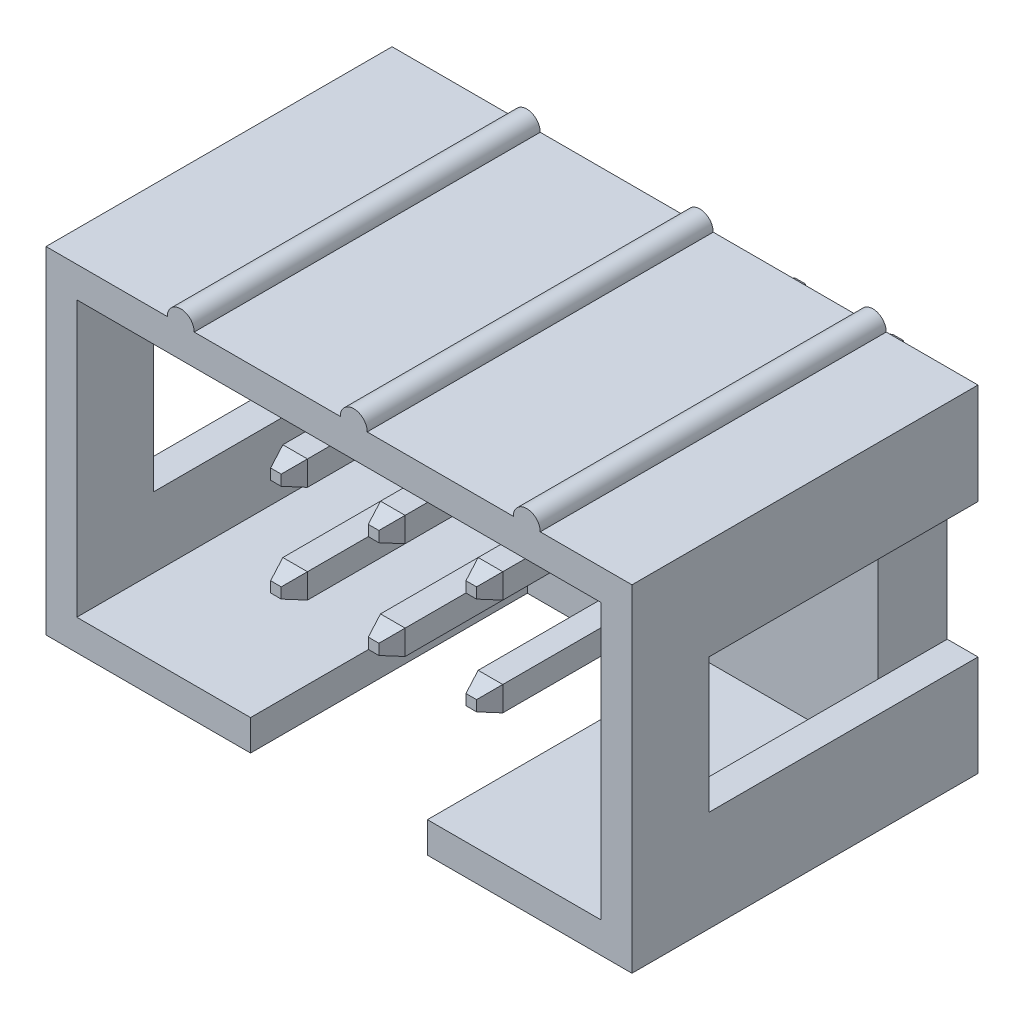
from build123d import *
from OCP.BRepFilletAPI import BRepFilletAPI_MakeChamfer

# Parameters (mm, degrees)
SKETCH_1_W               = 15.24
SKETCH_1_H               = 8.75
EXTRUDE_1_DEPTH          = 1.8
SKETCH_2_W               = 15.24
SKETCH_2_H               = 8.75
SKETCH_2_W_2             = 13.64
SKETCH_2_H_2             = 7.15
EXTRUDE_2_DEPTH          = 7.2
CUT_EXTRUDE_START        = -1.8
SKETCH_3_W               = 0.8
SKETCH_3_H               = 3.5
CUT_EXTRUDE_1_DEPTH      = 7
SKETCH_4_W               = 4.6
SKETCH_4_H               = 0.8
CUT_EXTRUDE_2_DEPTH      = 7.2
EXTRUDE_3_DEPTH          = 6.3
EXTRUDE_3_DEPTH_BACK     = 4.8
SKETCH_5_W               = 0.64
SKETCH_5_H               = 0.64
CHAMFER_2_SIZE           = 0.5
CHAMFER_2_SIZE2          = 0.181985117
CHAMFER_8_SIZE           = 0.5
CHAMFER_8_SIZE2          = 0.181985117
CUT_EXTRUDE_3_DEPTH      = 0.1
PATTERN_LINEAR_1_COUNT   = 2
PATTERN_LINEAR_1_PITCH   = 2.54
PATTERN_LINEAR_1_2_COUNT = 2
PATTERN_LINEAR_1_2_PITCH = 2.54
PATTERN_LINEAR_2_COUNT   = 2
PATTERN_LINEAR_2_PITCH   = 2.54
SKETCH_7_R               = 0.35
EXTRUDE_4_DEPTH          = 9


with BuildPart() as part:
    # Эскиз1 → Бобышка-Вытянуть1 (new body)
    with BuildSketch(Plane.XY):
        Rectangle(SKETCH_1_W, SKETCH_1_H)
    extrude(amount=EXTRUDE_1_DEPTH)

    # Эскиз2 → Бобышка-Вытянуть2 (add)
    with BuildSketch(Plane.XY.offset(1.8)):
        Rectangle(SKETCH_2_W, SKETCH_2_H)
        Rectangle(SKETCH_2_W_2, SKETCH_2_H_2, mode=Mode.SUBTRACT)
    extrude(amount=EXTRUDE_2_DEPTH)

    # Эскиз3 → Вырез-Вытянуть1 (cut)
    with BuildSketch(Plane.XY.offset(1.8).offset(CUT_EXTRUDE_START)):
        with Locations((7.22, 0)):
            Rectangle(SKETCH_3_W, SKETCH_3_H)
        with Locations((-7.22, 0)):
            Rectangle(SKETCH_3_W, SKETCH_3_H)
    extrude(amount=CUT_EXTRUDE_1_DEPTH, mode=Mode.SUBTRACT)

    # Эскиз4 → Вырез-Вытянуть2 (cut)
    with BuildSketch(Plane.XY.offset(9)):
        with Locations((0, -3.975)):
            Rectangle(SKETCH_4_W, SKETCH_4_H)
    extrude(amount=-CUT_EXTRUDE_2_DEPTH, mode=Mode.SUBTRACT)

    # Эскиз6 → Вырез-Вытянуть3 (cut)
    with BuildSketch(Plane.XZ.offset(4.375)):
        Polygon((-4.976440372, 5.189720174), (-3.184624847, 5.189720174), (-4.08053261, 3.716247509), align=None)
    extrude(amount=-CUT_EXTRUDE_3_DEPTH, mode=Mode.SUBTRACT)

    # Эскиз7 → Бобышка-Вытянуть4 (add)
    with BuildSketch(Plane(origin=(0, -4.625, 9), x_dir=(1, 0, 0), z_dir=(0, 0, -1))):
        with Locations((0.384038173, -9)):
            Circle(SKETCH_7_R)
        with Locations((4.884038173, -9)):
            Circle(SKETCH_7_R)
        with Locations((-4.115961827, -9)):
            Circle(SKETCH_7_R)
    extrude(amount=EXTRUDE_4_DEPTH)


with BuildPart() as body_2:
    # Эскиз5 → Бобышка-Вытянуть3 (new, two sides: drawn at the far end of the back side and taken through both)
    with BuildSketch(Plane.XY.offset(1.8).offset(-EXTRUDE_3_DEPTH_BACK)):
        with Locations((0, 1.27)):
            Rectangle(SKETCH_5_W, SKETCH_5_H)
    extrude(amount=EXTRUDE_3_DEPTH + EXTRUDE_3_DEPTH_BACK)

    # Фаска2: one chamfer whose edges measure the first distance from different faces: ONE call of the kernel's chamfer builder (chamfer() names one face for all edges)
    chamfer_2_edges_1 = [body_2.edges().sort_by_distance(p)[0] for p in [
        (-0.32, 1.27, -3),
    ]]
    chamfer_2_side_1 = [body_2.faces().sort_by_distance(p)[0] for p in [
        (-0.32, 1.27, 2.55),
    ]]
    chamfer_2_edges_2 = [body_2.edges().sort_by_distance(p)[0] for p in [
        (0, 1.59, -3),
    ]]
    chamfer_2_side_2 = [body_2.faces().sort_by_distance(p)[0] for p in [
        (0, 1.59, 2.55),
    ]]
    chamfer_2_edges_3 = [body_2.edges().sort_by_distance(p)[0] for p in [
        (0.32, 1.27, -3),
    ]]
    chamfer_2_side_3 = [body_2.faces().sort_by_distance(p)[0] for p in [
        (0.32, 1.27, 2.55),
    ]]
    chamfer_2_edges_4 = [body_2.edges().sort_by_distance(p)[0] for p in [
        (0, 0.95, -3),
    ]]
    chamfer_2_side_4 = [body_2.faces().sort_by_distance(p)[0] for p in [
        (0, 0.95, 2.55),
    ]]
    chamfer_2 = BRepFilletAPI_MakeChamfer(body_2.part.solid().wrapped)
    for e in chamfer_2_edges_1:
        chamfer_2.Add(CHAMFER_2_SIZE, CHAMFER_2_SIZE2, e.wrapped, chamfer_2_side_1[0].wrapped)  # the first distance lies on this face
    for e in chamfer_2_edges_2:
        chamfer_2.Add(CHAMFER_2_SIZE, CHAMFER_2_SIZE2, e.wrapped, chamfer_2_side_2[0].wrapped)  # the first distance lies on this face
    for e in chamfer_2_edges_3:
        chamfer_2.Add(CHAMFER_2_SIZE, CHAMFER_2_SIZE2, e.wrapped, chamfer_2_side_3[0].wrapped)  # the first distance lies on this face
    for e in chamfer_2_edges_4:
        chamfer_2.Add(CHAMFER_2_SIZE, CHAMFER_2_SIZE2, e.wrapped, chamfer_2_side_4[0].wrapped)  # the first distance lies on this face
    add(Compound.cast(chamfer_2.Shape()), mode=Mode.REPLACE)

    # Фаска8: one chamfer whose edges measure the first distance from different faces: ONE call of the kernel's chamfer builder (chamfer() names one face for all edges)
    chamfer_8_edges_1 = [body_2.edges().sort_by_distance(p)[0] for p in [
        (0, 1.59, 8.1),
    ]]
    chamfer_8_side_1 = [body_2.faces().sort_by_distance(p)[0] for p in [
        (0, 1.59, 2.8),
    ]]
    chamfer_8_edges_2 = [body_2.edges().sort_by_distance(p)[0] for p in [
        (0.32, 1.27, 8.1),
    ]]
    chamfer_8_side_2 = [body_2.faces().sort_by_distance(p)[0] for p in [
        (0.32, 1.27, 2.8),
    ]]
    chamfer_8_edges_3 = [body_2.edges().sort_by_distance(p)[0] for p in [
        (0, 0.95, 8.1),
    ]]
    chamfer_8_side_3 = [body_2.faces().sort_by_distance(p)[0] for p in [
        (0, 0.95, 2.8),
    ]]
    chamfer_8_edges_4 = [body_2.edges().sort_by_distance(p)[0] for p in [
        (-0.32, 1.27, 8.1),
    ]]
    chamfer_8_side_4 = [body_2.faces().sort_by_distance(p)[0] for p in [
        (-0.32, 1.27, 2.8),
    ]]
    chamfer_8 = BRepFilletAPI_MakeChamfer(body_2.part.solid().wrapped)
    for e in chamfer_8_edges_1:
        chamfer_8.Add(CHAMFER_8_SIZE, CHAMFER_8_SIZE2, e.wrapped, chamfer_8_side_1[0].wrapped)  # the first distance lies on this face
    for e in chamfer_8_edges_2:
        chamfer_8.Add(CHAMFER_8_SIZE, CHAMFER_8_SIZE2, e.wrapped, chamfer_8_side_2[0].wrapped)  # the first distance lies on this face
    for e in chamfer_8_edges_3:
        chamfer_8.Add(CHAMFER_8_SIZE, CHAMFER_8_SIZE2, e.wrapped, chamfer_8_side_3[0].wrapped)  # the first distance lies on this face
    for e in chamfer_8_edges_4:
        chamfer_8.Add(CHAMFER_8_SIZE, CHAMFER_8_SIZE2, e.wrapped, chamfer_8_side_4[0].wrapped)  # the first distance lies on this face
    add(Compound.cast(chamfer_8.Shape()), mode=Mode.REPLACE)


with BuildPart() as pattern_linear_1_1:
    # Линейный массив1: pattern copy
    add(body_2.part.moved(Location(Vector(-1, 0, 0) * (1 * PATTERN_LINEAR_1_PITCH))))


with BuildPart() as pattern_linear_1_2_1:
    # Pattern Linear 1 2: pattern copy
    add(body_2.part.moved(Location(Vector(0, -1, 0) * (1 * PATTERN_LINEAR_1_2_PITCH))))


with BuildPart() as pattern_linear_1_2_2:
    # Pattern Linear 1 2: pattern copy
    add(pattern_linear_1_1.part.moved(Location(Vector(0, -1, 0) * (1 * PATTERN_LINEAR_1_2_PITCH))))


with BuildPart() as pattern_linear_2_1:
    # Линейный массив2: pattern copy
    add(pattern_linear_1_2_1.part.moved(Location(Vector(1, 0, 0) * (1 * PATTERN_LINEAR_2_PITCH))))


with BuildPart() as pattern_linear_2_2:
    # Линейный массив2: pattern copy
    add(body_2.part.moved(Location(Vector(1, 0, 0) * (1 * PATTERN_LINEAR_2_PITCH))))


solid = Compound([part.part, body_2.part, pattern_linear_1_1.part, pattern_linear_1_2_1.part, pattern_linear_1_2_2.part, pattern_linear_2_1.part, pattern_linear_2_2.part])
